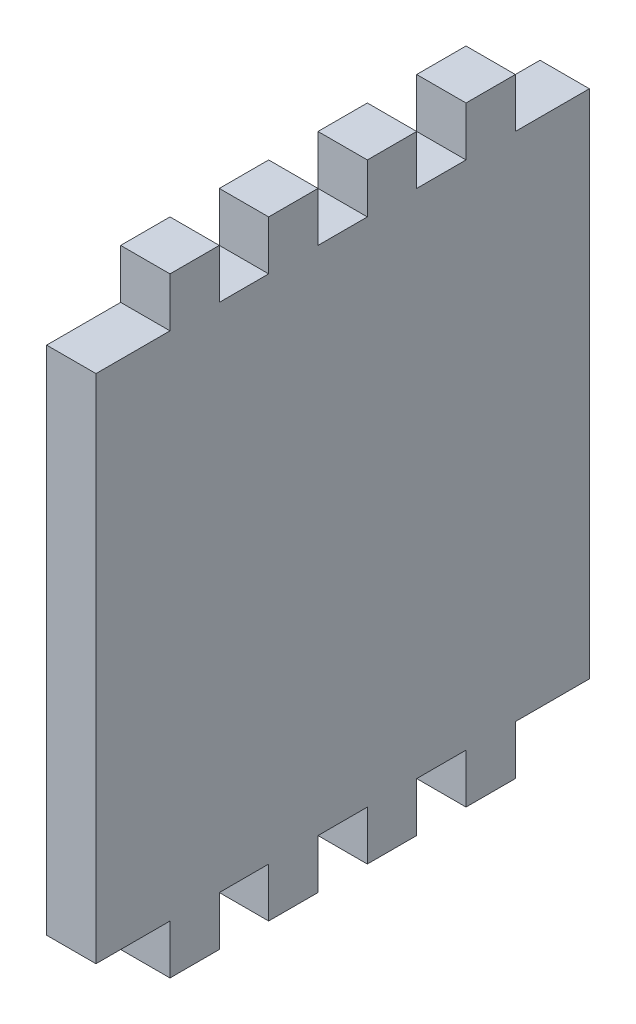
from build123d import *

# Parameters (mm, degrees)
SKETCH1_W           = 50.8
SKETCH1_H           = 52.62626
BOSS_EXTRUDE1_DEPTH = 5.08
SKETCH2_W           = 5.08
SKETCH2_H           = 5.08
BOSS_EXTRUDE2_DEPTH = 5.08


with BuildPart() as part:
    # Sketch1 → Boss-Extrude1 (new body)
    with BuildSketch(Plane(origin=(0, 0, 0), x_dir=(0, 0, -1), z_dir=(1, 0, 0))):
        with Locations((5.176303318, -12.22876981)):
            Rectangle(SKETCH1_W, SKETCH1_H)
    extrude(amount=BOSS_EXTRUDE1_DEPTH)

    # Sketch2 → Boss-Extrude2 (add)
    with BuildSketch(Plane(origin=(5.08, 0, 0), x_dir=(0, 0, -1), z_dir=(1, 0, 0))):
        with Locations((-10.063696682, 16.62436019)):
            Rectangle(SKETCH2_W, SKETCH2_H)
        with Locations((10.256303318, 16.62436019)):
            Rectangle(SKETCH2_W, SKETCH2_H)
        with Locations((20.416303318, 16.62436019)):
            Rectangle(SKETCH2_W, SKETCH2_H)
        with Locations((0.096303318, 16.62436019)):
            Rectangle(SKETCH2_W, SKETCH2_H)
        with Locations((0.096303318, -41.08189981)):
            Rectangle(SKETCH2_W, SKETCH2_H)
        with Locations((-10.063696682, -41.08189981)):
            Rectangle(SKETCH2_W, SKETCH2_H)
        with Locations((20.416303318, -41.08189981)):
            Rectangle(SKETCH2_W, SKETCH2_H)
        with Locations((10.256303318, -41.08189981)):
            Rectangle(SKETCH2_W, SKETCH2_H)
    extrude(amount=-BOSS_EXTRUDE2_DEPTH)


solid = part.part
